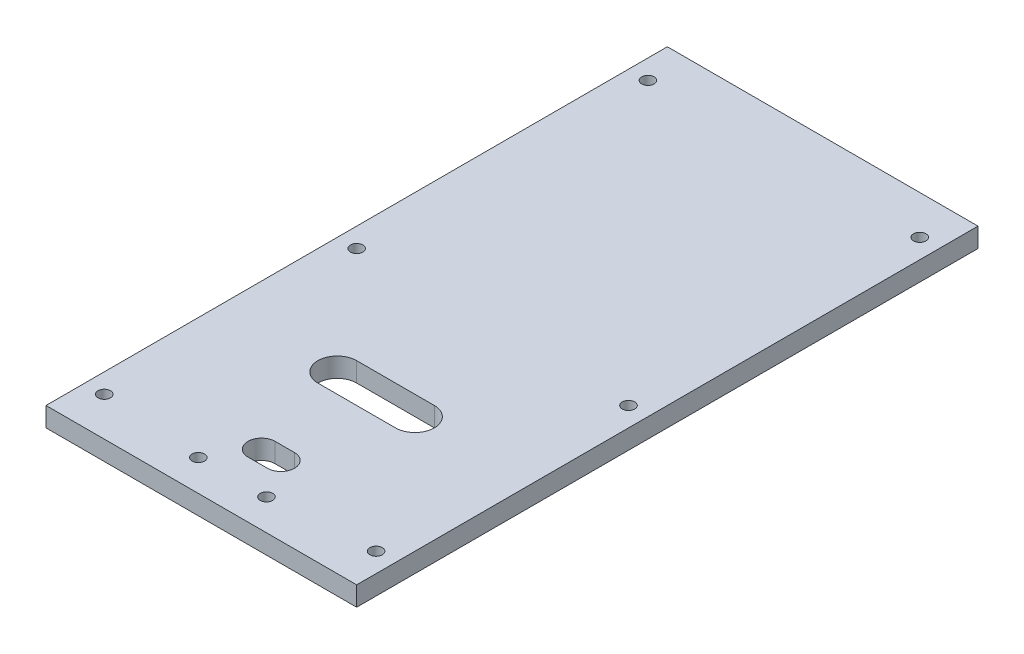
from build123d import *

# Parameters (mm, degrees)
ESQUISSE1_W              = 80
ESQUISSE1_H              = 160
BOSS_EXTRU_1_DEPTH       = 5
ESQUISSE2_R              = 1.6
ENL_V_MAT_EXTRU_8_DEPTH  = 10
ESQUISSE3_R              = 1.6
ENL_V_MAT_EXTRU_10_DEPTH = 10
ENL_V_MAT_EXTRU_11_DEPTH = 179.955301682


with BuildPart() as part:
    # Esquisse1 → Boss.-Extru.1 (new body)
    with BuildSketch(Plane(origin=(0, 0, 0), x_dir=(1, 0, 0), z_dir=(0, 1, 0))):
        with Locations((40, 80)):
            Rectangle(ESQUISSE1_W, ESQUISSE1_H)
    extrude(amount=BOSS_EXTRU_1_DEPTH)

    # Esquisse2 → Enlèv. mat.-Extru.8 (cut)
    with BuildSketch(Plane(origin=(0, 0, 0), x_dir=(1, 0, 0), z_dir=(0, 1, 0))):
        with Locations(Location((5, 150, 0), (0, 0, 90))):
            Circle(ESQUISSE2_R)
        with Locations(Location((5, 75, 0), (0, 0, 90))):
            Circle(ESQUISSE2_R)
        with Locations(Location((5, 10, 0), (0, 0, 90))):
            Circle(ESQUISSE2_R)
        with Locations(Location((75, 10, 0), (0, 0, 90))):
            Circle(ESQUISSE2_R)
        with Locations(Location((75, 75, 0), (0, 0, 90))):
            Circle(ESQUISSE2_R)
        with Locations(Location((75, 150, 0), (0, 0, 90))):
            Circle(ESQUISSE2_R)
    extrude(amount=ENL_V_MAT_EXTRU_8_DEPTH, mode=Mode.SUBTRACT)

    # Esquisse3 → Enlèv. mat.-Extru.10 (cut)
    with BuildSketch(Plane(origin=(0, 0, 0), x_dir=(1, 0, 0), z_dir=(0, 1, 0))):
        with Locations(Location((31.225, 8, 0), (0, 0, 90))):
            Circle(ESQUISSE3_R)
        with Locations(Location((48.775, 8, 0), (0, 0, 90))):
            Circle(ESQUISSE3_R)
    extrude(amount=ENL_V_MAT_EXTRU_10_DEPTH, mode=Mode.SUBTRACT)

    # Esquisse4 → Enlèv. mat.-Extru.11 (cut, through all)
    with BuildSketch(Plane(origin=(0, 5, 0), x_dir=(1, 0, 0), z_dir=(0, 1, 0))):
        with BuildLine():
            Line((37.5, 21.5), (42.5, 21.5))
            ThreePointArc((42.5, 21.5), (46, 18), (42.5, 14.5))
            Line((42.5, 14.5), (37.5, 14.5))
            ThreePointArc((37.5, 14.5), (34, 18), (37.5, 21.5))
        make_face()
        with BuildLine():
            Line((30, 50), (50, 50))
            ThreePointArc((50, 50), (55, 45), (50, 40))
            Line((50, 40), (30, 40))
            ThreePointArc((30, 40), (25, 45), (30, 50))
        make_face()
    extrude(amount=-ENL_V_MAT_EXTRU_11_DEPTH, mode=Mode.SUBTRACT)


solid = part.part
